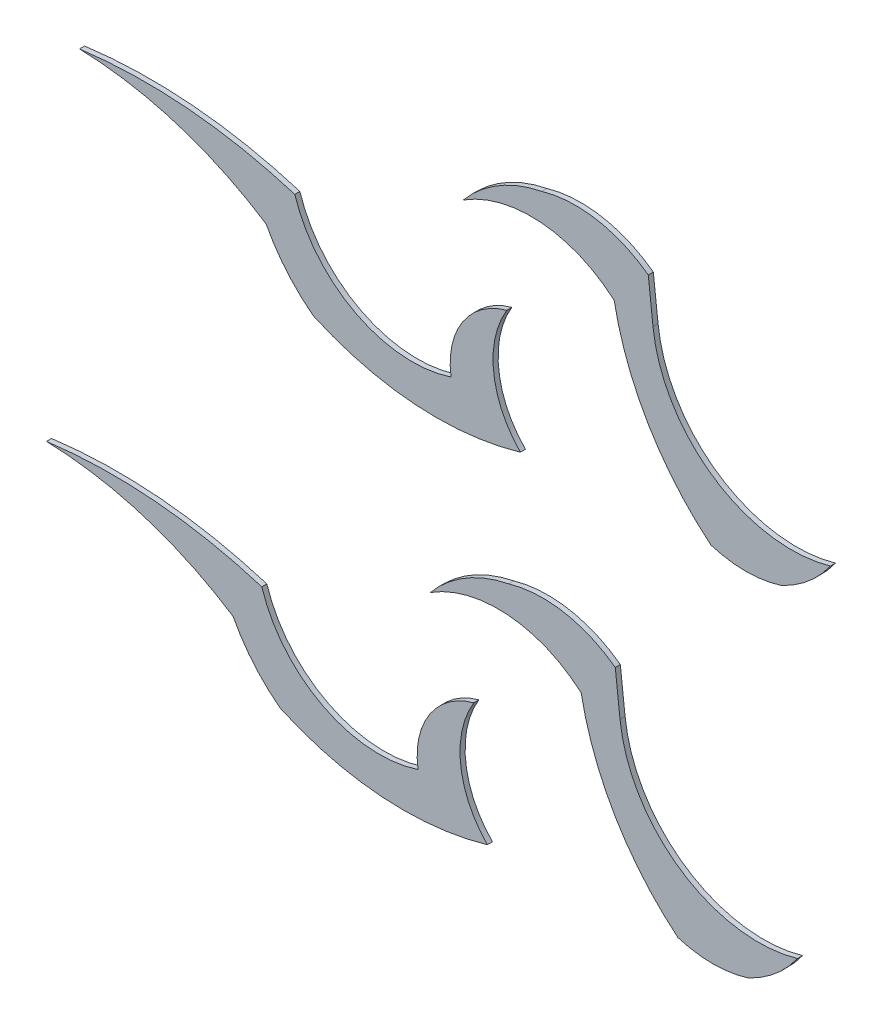
from build123d import *

# Parameters (mm, degrees)
EXTRUDE_1_DEPTH   = 0.5
EXTRUDE_1_2_DEPTH = 0.5
EXTRUDE_2_DEPTH   = 0.5
EXTRUDE_2_2_DEPTH = 0.5


with BuildPart() as part:
    # 스케치1 → 보스-돌출1 (new body)
    with BuildSketch(Plane.XY):
        with BuildLine():
            ThreePointArc((8.80264913, 0.140869244), (7.506632055, -5.81118181), (10.138692018, -11.304708216))
            ThreePointArc((10.138692018, -11.304708216), (-0.201362224, -12.414076053), (-10.280813271, -9.85437191))
            ThreePointArc((-10.280813271, -9.85437191), (-12.901179897, -7.354989134), (-14.917002582, -4.346718132))
            ThreePointArc((-14.917002582, -4.346718132), (-23.714318194, -0.209715139), (-33.303336459, 1.389748659))
            ThreePointArc((-33.303336459, 1.389748659), (-22.597655992, 1.638737324), (-12.087135719, -0.411275657))
            ThreePointArc((-12.087135719, -0.411275657), (-6.040259136, -7.578468463), (3.30881362, -8.305247475))
            ThreePointArc((3.30881362, -8.305247475), (4.442592157, -3.032911463), (8.80264913, 0.140869244))
        make_face()
    extrude(amount=EXTRUDE_1_DEPTH)


with BuildPart() as body_2:
    # 스케치1 → Extrude 1 2 (new body)
    with BuildSketch(Plane.XY):
        with BuildLine():
            ThreePointArc((23.207530181, 5.937314506), (29.232017356, -3.970373513), (40.691876207, -5.739091327))
            ThreePointArc((40.691876207, -5.739091327), (38.540272021, -8.090988252), (35.860596622, -9.817302093))
            ThreePointArc((35.860596622, -9.817302093), (32.388303853, -10.361902877), (28.912906874, -9.837476602))
            ThreePointArc((28.912906874, -9.837476602), (22.738240984, -2.609414461), (19.379772094, 6.283957671))
            ThreePointArc((19.379772094, 6.283957671), (12.133212194, 9.319636927), (4.512838786, 7.407076324))
            ThreePointArc((4.512838786, 7.407076324), (7.989536066, 10.373242432), (12.255402618, 12.01273867))
            ThreePointArc((12.255402618, 12.01273867), (17.721222854, 12.297674999), (22.742746753, 10.120365355))
            Line((22.742746753, 10.120365355), (23.207530181, 5.937314506))
        make_face()
    extrude(amount=EXTRUDE_1_2_DEPTH)


with BuildPart() as body_3:
    # 스케치1<3> → 보스-돌출2 (new body)
    with BuildSketch(Plane.XY):
        with BuildLine():
            ThreePointArc((19.95511172, -29.18045151), (25.979598894, -39.088139529), (37.439457746, -40.856857342))
            ThreePointArc((37.439457746, -40.856857342), (35.287853559, -43.208754268), (32.60817816, -44.935068109))
            ThreePointArc((32.60817816, -44.935068109), (29.135885392, -45.479668893), (25.660488413, -44.955242618))
            ThreePointArc((25.660488413, -44.955242618), (19.485822522, -37.727180477), (16.127353633, -28.833808345))
            ThreePointArc((16.127353633, -28.833808345), (8.880793733, -25.798129088), (1.260420325, -27.710689692))
            ThreePointArc((1.260420325, -27.710689692), (4.737117605, -24.744523584), (9.002984157, -23.105027346))
            ThreePointArc((9.002984157, -23.105027346), (14.468804392, -22.820091017), (19.490328292, -24.99740066))
            Line((19.490328292, -24.99740066), (19.95511172, -29.18045151))
        make_face()
    extrude(amount=EXTRUDE_2_DEPTH)


with BuildPart() as body_4:
    # 스케치1<3> → Extrude 2 2 (new body)
    with BuildSketch(Plane.XY):
        with BuildLine():
            ThreePointArc((5.550230669, -34.976896772), (4.254213594, -40.928947826), (6.886273557, -46.422474231))
            ThreePointArc((6.886273557, -46.422474231), (-3.453780685, -47.531842069), (-13.533231733, -44.972137926))
            ThreePointArc((-13.533231733, -44.972137926), (-16.153598359, -42.47275515), (-18.169421044, -39.464484148))
            ThreePointArc((-18.169421044, -39.464484148), (-26.966736655, -35.327481155), (-36.55575492, -33.728017357))
            ThreePointArc((-36.55575492, -33.728017357), (-25.850074453, -33.479028692), (-15.339554181, -35.529041673))
            ThreePointArc((-15.339554181, -35.529041673), (-9.292677597, -42.696234479), (0.056395159, -43.423013491))
            ThreePointArc((0.056395159, -43.423013491), (1.190173695, -38.150677479), (5.550230669, -34.976896772))
        make_face()
    extrude(amount=EXTRUDE_2_2_DEPTH)


solid = Compound([part.part, body_2.part, body_3.part, body_4.part])
